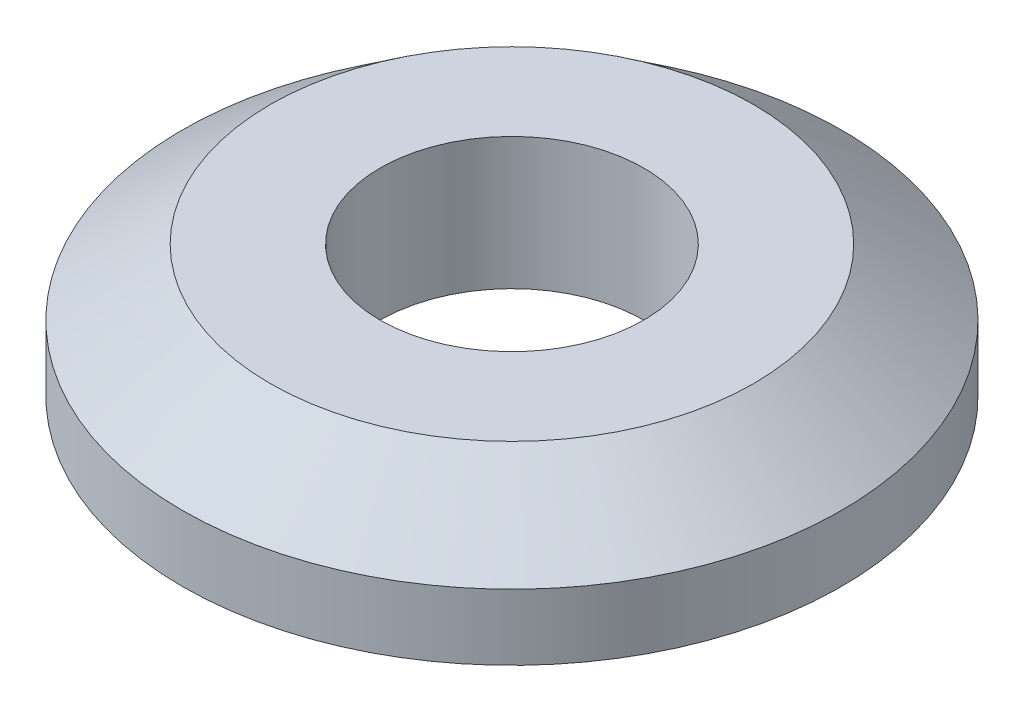
from build123d import *

# Parameters (mm, degrees)
SKETCH_1_R      = 7.5
SKETCH_1_R_2    = 3
EXTRUDE_1_DEPTH = 3
CHAMFER_1_SIZE  = 1.5
CHAMFER_1_SIZE2 = 2


with BuildPart() as part:
    # 草图1 → 凸台-拉伸1 (new body)
    with BuildSketch(Plane(origin=(0, 0, 0), x_dir=(1, 0, 0), z_dir=(0, 1, 0))):
        with Locations(Location((0, 0, 0), (0, 0, 270))):
            Circle(SKETCH_1_R)
        with Locations(Location((0, 0, 0), (0, 0, 270))):
            Circle(SKETCH_1_R_2, mode=Mode.SUBTRACT)
    extrude(amount=EXTRUDE_1_DEPTH)

    # 倒角1
    chamfer_1_edges = [part.edges().sort_by_distance(p)[0] for p in [
        (0, 3, -7.5),
    ]]
    chamfer_1_side = [part.faces().sort_by_distance(p)[0] for p in [
        (0, 1.5, -7.5),
    ]]
    chamfer(chamfer_1_edges, length=CHAMFER_1_SIZE, length2=CHAMFER_1_SIZE2, reference=chamfer_1_side[0])


solid = part.part
